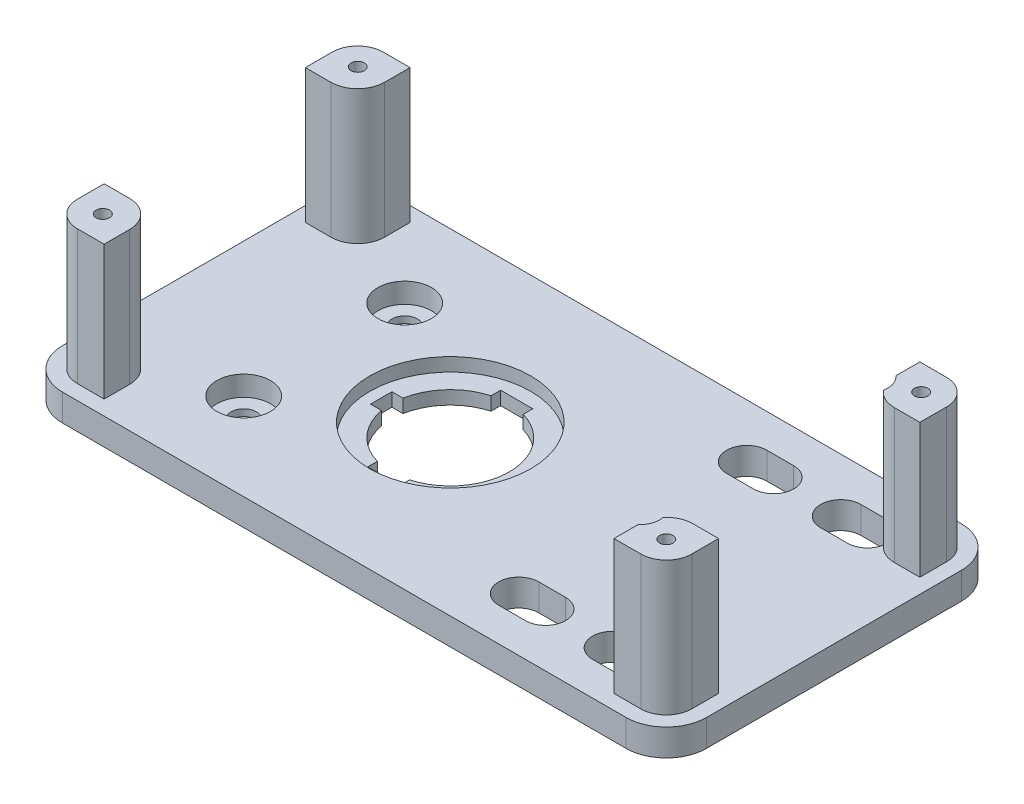
from build123d import *

# Parameters (mm, degrees)
SKETCH1_W           = 121.92
SKETCH1_H           = 63.5
BOSS_EXTRUDE1_DEPTH = 5.08
FILLET1_R           = 7.62
SKETCH2_W           = 9.906
SKETCH2_H           = 9.906
BOSS_EXTRUDE2_DEPTH = 22.86
CUT_EXTRUDE2_REACH  = 142.276
SKETCH5_R           = 10.9982
CUT_EXTRUDE3_REACH  = 142.276
SKETCH6_R           = 1.9939
SKETCH7_R           = 5.08
CUT_EXTRUDE4_DEPTH  = 3.81
SKETCH8_R           = 15.24
CUT_EXTRUDE5_DEPTH  = 2.54
CUT_EXTRUDE6_REACH  = 142.276
SKETCH9_R           = 2.159
CUT_EXTRUDE7_REACH  = 142.276
SKETCH11_W          = 143.390320112
SKETCH11_H          = 95.839563071
CUT_EXTRUDE8_DEPTH  = 5.08
SKETCH14_W          = 9.906
SKETCH14_H          = 9.906
BOSS_EXTRUDE4_DEPTH = 7.62
FILLET2_R           = 4.826
FILLET3_R           = 5.08
SKETCH15_R          = 1.27
CUT_EXTRUDE10_DEPTH = 20.32
CUT_EXTRUDE11_REACH = 142.804
SKETCH16_R          = 2.413
CUT_EXTRUDE12_START = -2.54
SKETCH17_W          = 6.096
SKETCH17_H          = 25.146
SKETCH17_W_2        = 2.38136189
SKETCH17_H_2        = 4.064
CUT_EXTRUDE12_DEPTH = 2.54
CUT_EXTRUDE13_REACH = 142.804


with BuildPart() as part:
    # Sketch1 → Boss-Extrude1 (new body)
    with BuildSketch(Plane(origin=(0, 0, 0), x_dir=(1, 0, 0), z_dir=(0, 1, 0))):
        with Locations((60.96, 31.75)):
            Rectangle(SKETCH1_W, SKETCH1_H)
    extrude(amount=BOSS_EXTRUDE1_DEPTH)

    # Fillet1
    fillet1_edges = [part.edges().sort_by_distance(p)[0] for p in [
        (0, 2.54, -63.5),
        (121.92, 2.54, -63.5),
        (121.92, 2.54, 0),
        (0, 2.54, 0),
    ]]
    fillet(fillet1_edges, radius=FILLET1_R)

    # Sketch2 → Boss-Extrude2 (add)
    with BuildSketch(Plane(origin=(0, 5.08, 0), x_dir=(1, 0, 0), z_dir=(0, 1, 0))):
        with Locations((7.747, 55.753)):
            Rectangle(SKETCH2_W, SKETCH2_H)
        with Locations((114.173, 55.753)):
            Rectangle(SKETCH2_W, SKETCH2_H)
        with Locations((114.173, 7.747)):
            Rectangle(SKETCH2_W, SKETCH2_H)
        with Locations((7.747, 7.747)):
            Rectangle(SKETCH2_W, SKETCH2_H)
    extrude(amount=BOSS_EXTRUDE2_DEPTH)

    # Sketch5 → Cut-Extrude2 (cut, up to next)
    with BuildSketch(Plane.XZ, mode=Mode.PRIVATE) as cut_extrude2_sk1:
        with Locations(Location((49.276, -31.75, 0), (0, 0, 270))):
            Circle(SKETCH5_R)
    cut_extrude2_tool1 = extrude(cut_extrude2_sk1.sketch, amount=-CUT_EXTRUDE2_REACH, mode=Mode.PRIVATE) & part.part
    add(cut_extrude2_tool1.solids().sort_by_distance((49.276, 0, -31.75))[0], mode=Mode.SUBTRACT)

    # Sketch6 → Cut-Extrude3 (cut, up to next)
    with BuildSketch(Plane.XZ, mode=Mode.PRIVATE) as cut_extrude3_sk1:
        with Locations(Location((25.4, -16.51, 0), (0, 0, 270))):
            Circle(SKETCH6_R)
    cut_extrude3_tool1 = extrude(cut_extrude3_sk1.sketch, amount=-CUT_EXTRUDE3_REACH, mode=Mode.PRIVATE) & part.part
    # Sketch6 → Cut-Extrude3 (cut, up to next)
    with BuildSketch(Plane.XZ, mode=Mode.PRIVATE) as cut_extrude3_sk2:
        with Locations(Location((25.4, -46.99, 0), (0, 0, 270))):
            Circle(SKETCH6_R)
    cut_extrude3_tool2 = extrude(cut_extrude3_sk2.sketch, amount=-CUT_EXTRUDE3_REACH, mode=Mode.PRIVATE) & part.part
    add(cut_extrude3_tool1.solids().sort_by_distance((25.4, 0, -16.51))[0], mode=Mode.SUBTRACT)
    add(cut_extrude3_tool2.solids().sort_by_distance((25.4, 0, -46.99))[0], mode=Mode.SUBTRACT)

    # Sketch7 → Cut-Extrude4 (cut)
    with BuildSketch(Plane(origin=(0, 5.08, 0), x_dir=(1, 0, 0), z_dir=(0, 1, 0))):
        with Locations(Location((25.4, 46.99, 0), (0, 0, 270))):
            Circle(SKETCH7_R)
        with Locations(Location((25.4, 16.51, 0), (0, 0, 270))):
            Circle(SKETCH7_R)
    extrude(amount=-CUT_EXTRUDE4_DEPTH, mode=Mode.SUBTRACT)

    # Sketch8 → Cut-Extrude5 (cut)
    with BuildSketch(Plane(origin=(0, 5.08, 0), x_dir=(1, 0, 0), z_dir=(0, 1, 0))):
        with Locations(Location((49.276, 31.75, 0), (0, 0, 270))):
            Circle(SKETCH8_R)
    extrude(amount=-CUT_EXTRUDE5_DEPTH, mode=Mode.SUBTRACT)

    # Sketch9 → Cut-Extrude6 (cut, up to next)
    with BuildSketch(Plane.XZ, mode=Mode.PRIVATE) as cut_extrude6_sk1:
        with Locations(Location((25.4, -16.51, 0), (0, 0, 270))):
            Circle(SKETCH9_R)
    cut_extrude6_tool1 = extrude(cut_extrude6_sk1.sketch, amount=-CUT_EXTRUDE6_REACH, mode=Mode.PRIVATE) & part.part
    # Sketch9 → Cut-Extrude6 (cut, up to next)
    with BuildSketch(Plane.XZ, mode=Mode.PRIVATE) as cut_extrude6_sk2:
        with Locations(Location((25.4, -46.99, 0), (0, 0, 270))):
            Circle(SKETCH9_R)
    cut_extrude6_tool2 = extrude(cut_extrude6_sk2.sketch, amount=-CUT_EXTRUDE6_REACH, mode=Mode.PRIVATE) & part.part
    add(cut_extrude6_tool1.solids().sort_by_distance((25.4, 0, -16.51))[0], mode=Mode.SUBTRACT)
    add(cut_extrude6_tool2.solids().sort_by_distance((25.4, 0, -46.99))[0], mode=Mode.SUBTRACT)

    # Sketch10 → Cut-Extrude7 (cut, up to next)
    with BuildSketch(Plane.XZ, mode=Mode.PRIVATE) as cut_extrude7_sk1:
        with BuildLine():
            Line((52.324, -42.502333328), (52.324, -43.561))
            Line((52.324, -43.561), (46.228, -43.561))
            Line((46.228, -43.561), (46.228, -42.502333328))
            ThreePointArc((46.228, -42.502333328), (40.758626429, -38.985836057), (38.172393559, -33.02))
            Line((38.172393559, -33.02), (36.957, -33.02))
            Line((36.957, -33.02), (36.957, -30.48))
            Line((36.957, -30.48), (38.172393559, -30.48))
            ThreePointArc((38.172393559, -30.48), (40.758626429, -24.514163943), (46.228, -20.997666672))
            Line((46.228, -20.997666672), (46.228, -19.939))
            Line((46.228, -19.939), (52.324, -19.939))
            Line((52.324, -19.939), (52.324, -20.997666672))
            ThreePointArc((52.324, -20.997666672), (60.452, -31.75), (52.324, -42.502333328))
        make_face()
    cut_extrude7_tool1 = extrude(cut_extrude7_sk1.sketch, amount=-CUT_EXTRUDE7_REACH, mode=Mode.PRIVATE) & part.part
    add(cut_extrude7_tool1.solids().sort_by_distance((49.190062, 0, -31.75))[0], mode=Mode.SUBTRACT)

    # Sketch11 → Cut-Extrude8 (cut)
    with BuildSketch(Plane(origin=(0, 27.94, 0), x_dir=(1, 0, 0), z_dir=(0, 1, 0))):
        with Locations((59.888985007, 35.781035454)):
            Rectangle(SKETCH11_W, SKETCH11_H)
    extrude(amount=-CUT_EXTRUDE8_DEPTH, mode=Mode.SUBTRACT)

    # Sketch14 → Boss-Extrude4 (add)
    with BuildSketch(Plane(origin=(0, 22.86, 0), x_dir=(1, 0, 0), z_dir=(0, 1, 0))):
        with Locations((114.173, 7.747)):
            Rectangle(SKETCH14_W, SKETCH14_H)
        with Locations((7.747, 7.747)):
            Rectangle(SKETCH14_W, SKETCH14_H)
        with Locations((114.173, 55.753)):
            Rectangle(SKETCH14_W, SKETCH14_H)
        with Locations((7.747, 55.753)):
            Rectangle(SKETCH14_W, SKETCH14_H)
    extrude(amount=BOSS_EXTRUDE4_DEPTH)

    # Fillet2
    fillet2_edges = [part.edges().sort_by_distance(p)[0] for p in [
        (2.794, 17.78, -2.794),
        (119.126, 17.78, -2.794),
        (119.126, 17.78, -60.706),
        (2.794, 17.78, -60.706),
    ]]
    fillet(fillet2_edges, radius=FILLET2_R)

    # Fillet3
    fillet3_edges = [part.edges().sort_by_distance(p)[0] for p in [
        (12.7, 17.78, -12.7),
        (109.22, 17.78, -12.7),
        (109.22, 17.78, -50.8),
        (12.7, 17.78, -50.8),
    ]]
    fillet(fillet3_edges, radius=FILLET3_R)

    # Sketch15 → Cut-Extrude10 (cut)
    with BuildSketch(Plane(origin=(0, 30.48, 0), x_dir=(1, 0, 0), z_dir=(0, 1, 0))):
        with Locations(Location((114.3, 7.62, 0), (0, 0, 270))):
            Circle(SKETCH15_R)
        with Locations(Location((7.62, 7.62, 0), (0, 0, 270))):
            Circle(SKETCH15_R)
        with Locations(Location((114.3, 55.88, 0), (0, 0, 270))):
            Circle(SKETCH15_R)
        with Locations(Location((7.62, 55.88, 0), (0, 0, 270))):
            Circle(SKETCH15_R)
    extrude(amount=-CUT_EXTRUDE10_DEPTH, mode=Mode.SUBTRACT)

    # Sketch16 → Cut-Extrude11 (cut, up to next)
    with BuildSketch(Plane.XZ, mode=Mode.PRIVATE) as cut_extrude11_sk1:
        with Locations(Location((25.4, -16.51, 0), (0, 0, 270))):
            Circle(SKETCH16_R)
    cut_extrude11_tool1 = extrude(cut_extrude11_sk1.sketch, amount=-CUT_EXTRUDE11_REACH, mode=Mode.PRIVATE) & part.part
    # Sketch16 → Cut-Extrude11 (cut, up to next)
    with BuildSketch(Plane.XZ, mode=Mode.PRIVATE) as cut_extrude11_sk2:
        with Locations(Location((25.4, -46.99, 0), (0, 0, 270))):
            Circle(SKETCH16_R)
    cut_extrude11_tool2 = extrude(cut_extrude11_sk2.sketch, amount=-CUT_EXTRUDE11_REACH, mode=Mode.PRIVATE) & part.part
    add(cut_extrude11_tool1.solids().sort_by_distance((25.4, 0, -16.51))[0], mode=Mode.SUBTRACT)
    add(cut_extrude11_tool2.solids().sort_by_distance((25.4, 0, -46.99))[0], mode=Mode.SUBTRACT)

    # Sketch17 → Cut-Extrude12 (cut)
    with BuildSketch(Plane.XZ.offset(CUT_EXTRUDE12_START)):
        with Locations((49.276, -31.75)):
            Rectangle(SKETCH17_W, SKETCH17_H)
        with Locations((37.385680945, -31.75)):
            Rectangle(SKETCH17_W_2, SKETCH17_H_2)
    extrude(amount=CUT_EXTRUDE12_DEPTH, mode=Mode.SUBTRACT)

    # Sketch18 → Cut-Extrude13 (cut, up to next)
    with BuildSketch(Plane.XZ, mode=Mode.PRIVATE) as cut_extrude13_sk1:
        with BuildLine():
            Line((106.68, -13.97), (101.6, -13.97))
            ThreePointArc((101.6, -13.97), (97.79, -10.16), (101.6, -6.35))
            Line((101.6, -6.35), (106.68, -6.35))
            ThreePointArc((106.68, -6.35), (110.49, -10.16), (106.68, -13.97))
        make_face()
    cut_extrude13_tool1 = extrude(cut_extrude13_sk1.sketch, amount=-CUT_EXTRUDE13_REACH, mode=Mode.PRIVATE) & part.part
    # Sketch18 → Cut-Extrude13 (cut, up to next)
    with BuildSketch(Plane.XZ, mode=Mode.PRIVATE) as cut_extrude13_sk2:
        with BuildLine():
            Line((88.9, -13.97), (83.82, -13.97))
            ThreePointArc((83.82, -13.97), (80.01, -10.16), (83.82, -6.35))
            Line((83.82, -6.35), (88.9, -6.35))
            ThreePointArc((88.9, -6.35), (92.71, -10.16), (88.9, -13.97))
        make_face()
    cut_extrude13_tool2 = extrude(cut_extrude13_sk2.sketch, amount=-CUT_EXTRUDE13_REACH, mode=Mode.PRIVATE) & part.part
    # Sketch18 → Cut-Extrude13 (cut, up to next)
    with BuildSketch(Plane.XZ, mode=Mode.PRIVATE) as cut_extrude13_sk3:
        with BuildLine():
            Line((88.9, -57.15), (83.82, -57.15))
            ThreePointArc((83.82, -57.15), (80.01, -53.34), (83.82, -49.53))
            Line((83.82, -49.53), (88.9, -49.53))
            ThreePointArc((88.9, -49.53), (92.71, -53.34), (88.9, -57.15))
        make_face()
    cut_extrude13_tool3 = extrude(cut_extrude13_sk3.sketch, amount=-CUT_EXTRUDE13_REACH, mode=Mode.PRIVATE) & part.part
    # Sketch18 → Cut-Extrude13 (cut, up to next)
    with BuildSketch(Plane.XZ, mode=Mode.PRIVATE) as cut_extrude13_sk4:
        with BuildLine():
            Line((106.68, -57.15), (101.6, -57.15))
            ThreePointArc((101.6, -57.15), (97.79, -53.34), (101.6, -49.53))
            Line((101.6, -49.53), (106.68, -49.53))
            ThreePointArc((106.68, -49.53), (110.49, -53.34), (106.68, -57.15))
        make_face()
    cut_extrude13_tool4 = extrude(cut_extrude13_sk4.sketch, amount=-CUT_EXTRUDE13_REACH, mode=Mode.PRIVATE) & part.part
    add(cut_extrude13_tool1.solids().sort_by_distance((104.14, 0, -10.16))[0], mode=Mode.SUBTRACT)
    add(cut_extrude13_tool2.solids().sort_by_distance((86.36, 0, -10.16))[0], mode=Mode.SUBTRACT)
    add(cut_extrude13_tool3.solids().sort_by_distance((86.36, 0, -53.34))[0], mode=Mode.SUBTRACT)
    add(cut_extrude13_tool4.solids().sort_by_distance((104.14, 0, -53.34))[0], mode=Mode.SUBTRACT)


solid = part.part
